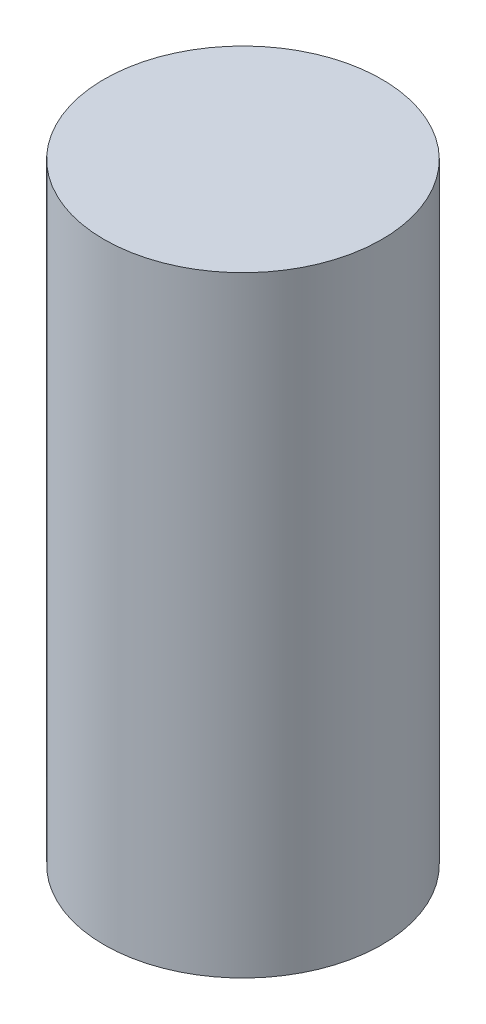
from build123d import *

# Parameters (mm, degrees)
SKETCH1_R           = 5
BOSS_EXTRUDE1_DEPTH = 11


with BuildPart() as part:
    # Sketch1 → Boss-Extrude1 (new, symmetric)
    with BuildSketch(Plane(origin=(0, 0, 0), x_dir=(1, 0, 0), z_dir=(0, 1, 0))):
        with Locations(Location((0, 0, 0), (0, 0, 270))):
            Circle(SKETCH1_R)
    extrude(amount=BOSS_EXTRUDE1_DEPTH, both=True)


solid = part.part
